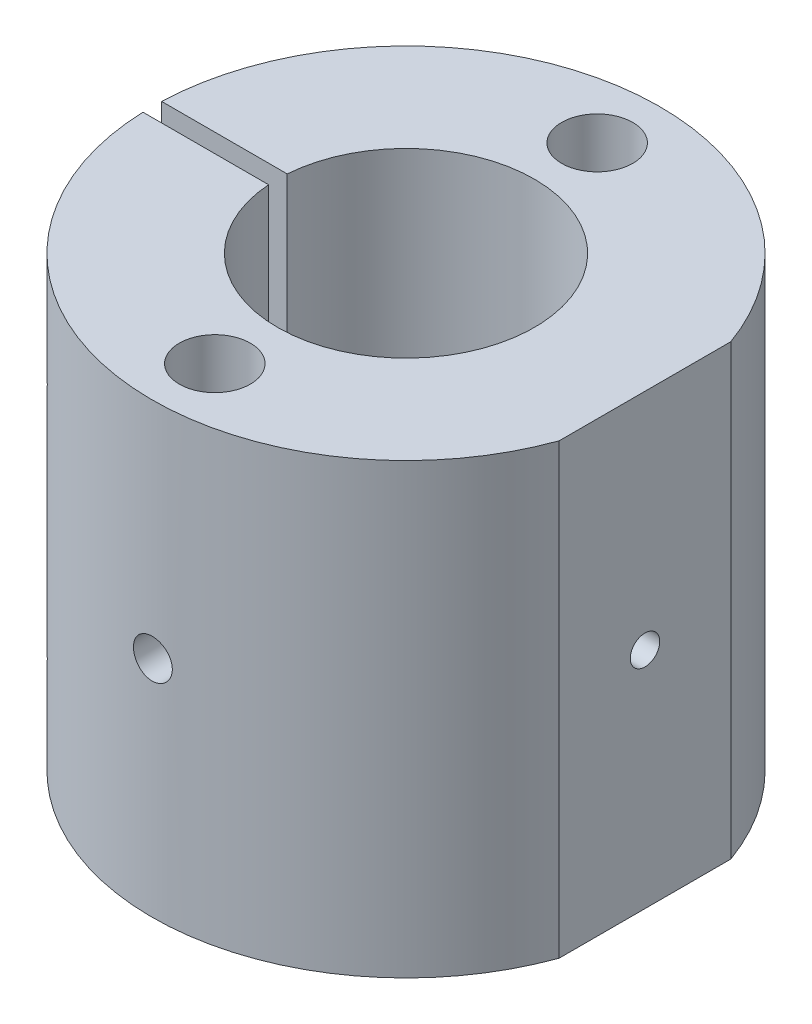
from build123d import *

# Parameters (mm, degrees)
SKETCH2_R                        = 21.59
SKETCH2_R_2                      = 10.922
BOSS_EXTRUDE1_DEPTH              = 38.1
CUT_EXTRUDE1_REACH               = 50.825
SKETCH3_W                        = 21.59
SKETCH3_H                        = 1.5875
CUT_EXTRUDE2_REACH               = 50.825
SKETCH4_R                        = 3.0226
TAP_DRILL_FOR_M4X0_7_TAP1_REACH  = 54.717
TAP_DRILL_FOR_M4X0_7_TAP1_BORE_R = 1.65
CUT_EXTRUDE5_REACH               = 63.5
CUT_EXTRUDE5_END_RADIUS          = 3.0226
SKETCH11_R                       = 1.65
CUT_EXTRUDE6_REACH               = 50.825
TAP_DRILL_FOR_M3X0_5_TAP2_D      = 2.5
TAP_DRILL_FOR_M3X0_5_TAP2_DEPTH  = 4.572
TAP_DRILL_FOR_M3X0_5_TAP2_TIP    = 0.751075774


with BuildPart() as part:
    # Sketch2 → Boss-Extrude1 (new body)
    with BuildSketch(Plane(origin=(0, 0, 0), x_dir=(1, 0, 0), z_dir=(0, 1, 0))):
        with Locations(Location((0, 0, 0), (0, 0, 90))):
            Circle(SKETCH2_R)
        with Locations(Location((0, 0, 0), (0, 0, 90))):
            Circle(SKETCH2_R_2, mode=Mode.SUBTRACT)
    extrude(amount=BOSS_EXTRUDE1_DEPTH)

    # Sketch3 → Cut-Extrude1 (cut, up to next)
    with BuildSketch(Plane(origin=(0, 38.1, 0), x_dir=(1, 0, 0), z_dir=(0, 1, 0)), mode=Mode.PRIVATE) as cut_extrude1_sk1:
        with Locations((-10.795, 0)):
            Rectangle(SKETCH3_W, SKETCH3_H)
    cut_extrude1_tool1 = extrude(cut_extrude1_sk1.sketch, amount=-CUT_EXTRUDE1_REACH, mode=Mode.PRIVATE) & part.part
    add(cut_extrude1_tool1.solids().sort_by_distance((-10.795, 38.1, 0))[0], mode=Mode.SUBTRACT)

    # Sketch4 → Cut-Extrude2 (cut, up to next)
    with BuildSketch(Plane(origin=(0, 38.1, 0), x_dir=(1, 0, 0), z_dir=(0, 1, 0)), mode=Mode.PRIVATE) as cut_extrude2_sk1:
        with Locations(Location((0, -16.256, 0), (0, 0, 270))):
            Circle(SKETCH4_R)
    cut_extrude2_tool1 = extrude(cut_extrude2_sk1.sketch, amount=-CUT_EXTRUDE2_REACH, mode=Mode.PRIVATE) & part.part
    cut_extrude2 = cut_extrude2_tool1.solids().sort_by_distance((0, 38.1, 16.256))[0]
    add(cut_extrude2, mode=Mode.SUBTRACT)

    # Tap Drill for M4x0.7 Tap1 bore (on position points) → Tap Drill for M4x0.7 Tap1 (cut, up to next)
    with BuildSketch(Plane(origin=(-16.234261615, 29.109235595, 0.79375), x_dir=(-1, 0, 0), z_dir=(0, 0, -1)), mode=Mode.PRIVATE) as tap_drill_for_m4x0_7_tap1_sk1:
        Circle(TAP_DRILL_FOR_M4X0_7_TAP1_BORE_R)
    tap_drill_for_m4x0_7_tap1_tool1 = extrude(tap_drill_for_m4x0_7_tap1_sk1.sketch, amount=-TAP_DRILL_FOR_M4X0_7_TAP1_REACH, mode=Mode.PRIVATE) & part.part
    # Tap Drill for M4x0.7 Tap1 bore (on position points) → Tap Drill for M4x0.7 Tap1 (cut, up to next)
    with BuildSketch(Plane(origin=(-16.234261615, 29.109235595, 0.79375), x_dir=(-1, 0, 0), z_dir=(0, 0, -1)), mode=Mode.PRIVATE) as tap_drill_for_m4x0_7_tap1_sk2:
        with Locations((0, -20.205281104)):
            Circle(TAP_DRILL_FOR_M4X0_7_TAP1_BORE_R)
    tap_drill_for_m4x0_7_tap1_tool2 = extrude(tap_drill_for_m4x0_7_tap1_sk2.sketch, amount=-TAP_DRILL_FOR_M4X0_7_TAP1_REACH, mode=Mode.PRIVATE) & part.part
    add(tap_drill_for_m4x0_7_tap1_tool1.solids().sort_by_distance((-16.234262, 29.109236, 0.79375))[0], mode=Mode.SUBTRACT)
    add(tap_drill_for_m4x0_7_tap1_tool2.solids().sort_by_distance((-16.234262, 8.903954, 0.79375))[0], mode=Mode.SUBTRACT)

    # Cut-Extrude5: up to this cylinder (the profile starts outside it)
    cut_extrude5_end = Plane(origin=(0, 19.05, 16.256), z_dir=(0, 1, 0)) * Cylinder(CUT_EXTRUDE5_END_RADIUS, 134.0452, mode=Mode.PRIVATE)
    # Sketch11 → Cut-Extrude5 (cut, up to the surface)
    with BuildSketch(Plane.XY.offset(21.59), mode=Mode.PRIVATE) as cut_extrude5_sk1:
        with Locations((0.007297963, 19.05)):
            Circle(SKETCH11_R)
    cut_extrude5_tool1 = extrude(cut_extrude5_sk1.sketch, amount=-CUT_EXTRUDE5_REACH, mode=Mode.PRIVATE) - cut_extrude5_end
    cut_extrude5 = cut_extrude5_tool1.solids().sort_by_distance((0.007298, 19.05, 21.59))[0]
    add(cut_extrude5, mode=Mode.SUBTRACT)

    # Mirror1: Cut-Extrude2, Cut-Extrude5 across plane
    add(cut_extrude2.mirror(Plane.XY), mode=Mode.SUBTRACT)
    add(cut_extrude5.mirror(Plane.XY), mode=Mode.SUBTRACT)

    # Sketch12 → Cut-Extrude6 (cut, up to next)
    with BuildSketch(Plane(origin=(0, 38.1, 0), x_dir=(1, 0, 0), z_dir=(0, 1, 0)), mode=Mode.PRIVATE) as cut_extrude6_sk1:
        with BuildLine():
            Line((20.32, 7.295594561), (20.32, -7.295594561))
            ThreePointArc((20.32, -7.295594561), (21.59, 0), (20.32, 7.295594561))
        make_face()
    cut_extrude6_tool1 = extrude(cut_extrude6_sk1.sketch, amount=-CUT_EXTRUDE6_REACH, mode=Mode.PRIVATE) & part.part
    add(cut_extrude6_tool1.solids().sort_by_distance((20.829303, 38.1, 0))[0], mode=Mode.SUBTRACT)

    # Tap Drill for M3x0.5 Tap2
    with Locations(Plane(origin=(20.32, 19.05, 0), x_dir=(0, 0, 1), z_dir=(1, 0, 0))):
        with Locations((0, 0)):
            Hole(TAP_DRILL_FOR_M3X0_5_TAP2_D / 2, depth=TAP_DRILL_FOR_M3X0_5_TAP2_DEPTH)
            with Locations((0, 0, -(TAP_DRILL_FOR_M3X0_5_TAP2_DEPTH + TAP_DRILL_FOR_M3X0_5_TAP2_TIP / 2))):  # 118° drill point
                Cone(0, TAP_DRILL_FOR_M3X0_5_TAP2_D / 2, TAP_DRILL_FOR_M3X0_5_TAP2_TIP, mode=Mode.SUBTRACT)


solid = part.part
